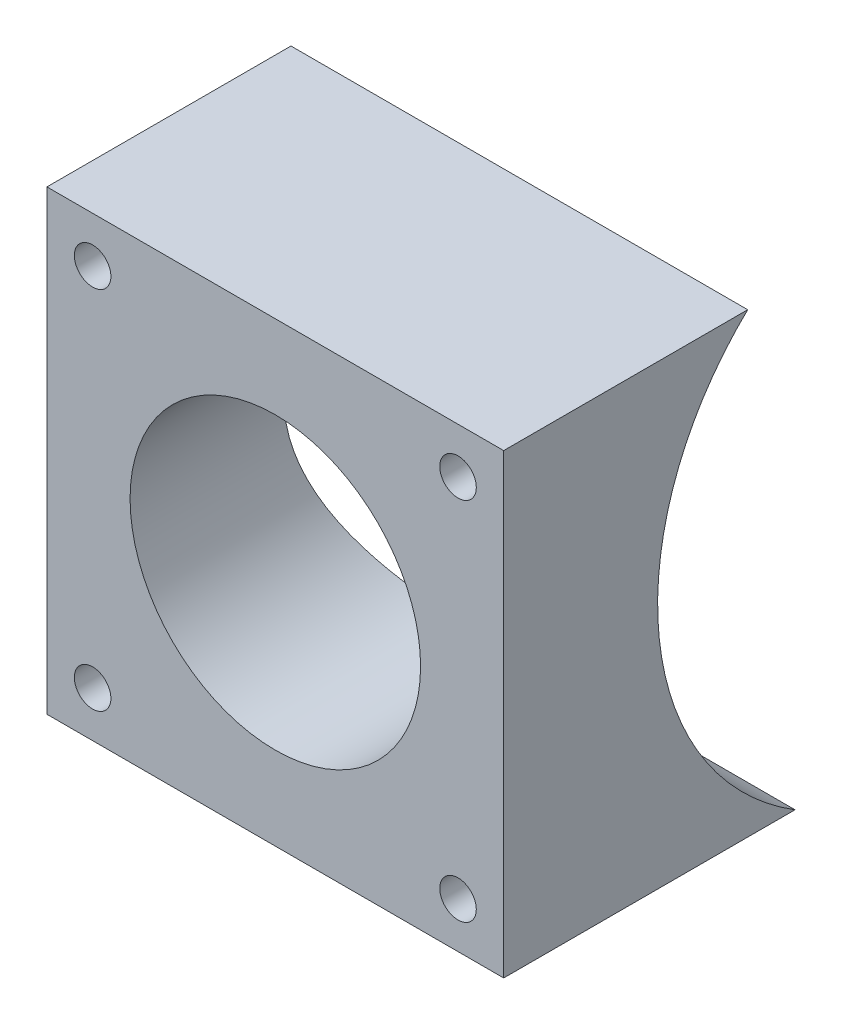
from build123d import *

# Parameters (mm, degrees)
SKETCH1_W               = 50
SKETCH1_H               = 50
SKETCH1_R               = 15.9
SKETCH1_R_2             = 2
BOSS_EXTRUDE1_DEPTH     = 48.6
CUT_EXTRUDE1_DEPTH      = 61.958674526
CUT_EXTRUDE1_DEPTH_BACK = 61.958674526
SKETCH2_R               = 31.75


with BuildPart() as part:
    # Sketch1 → Boss-Extrude1 (new body)
    with BuildSketch(Plane.XY):
        with Locations((0, -2)):
            Rectangle(SKETCH1_W, SKETCH1_H)
        with Locations((0, -2)):
            Circle(SKETCH1_R, mode=Mode.SUBTRACT)
        with Locations((-20, 18)):
            Circle(SKETCH1_R_2, mode=Mode.SUBTRACT)
        with Locations((20, 18)):
            Circle(SKETCH1_R_2, mode=Mode.SUBTRACT)
        with Locations((20, -22)):
            Circle(SKETCH1_R_2, mode=Mode.SUBTRACT)
        with Locations((-20, -22)):
            Circle(SKETCH1_R_2, mode=Mode.SUBTRACT)
    extrude(amount=BOSS_EXTRUDE1_DEPTH)

    # Sketch2 → Cut-Extrude1 (cut, two sides: drawn at the far end of the back side and taken through both)
    with BuildSketch(Plane(origin=(0, 0, 0), x_dir=(0, 0, -1), z_dir=(1, 0, 0)).offset(-CUT_EXTRUDE1_DEPTH_BACK)):
        Circle(SKETCH2_R)
    extrude(amount=CUT_EXTRUDE1_DEPTH + CUT_EXTRUDE1_DEPTH_BACK, mode=Mode.SUBTRACT)


solid = part.part
